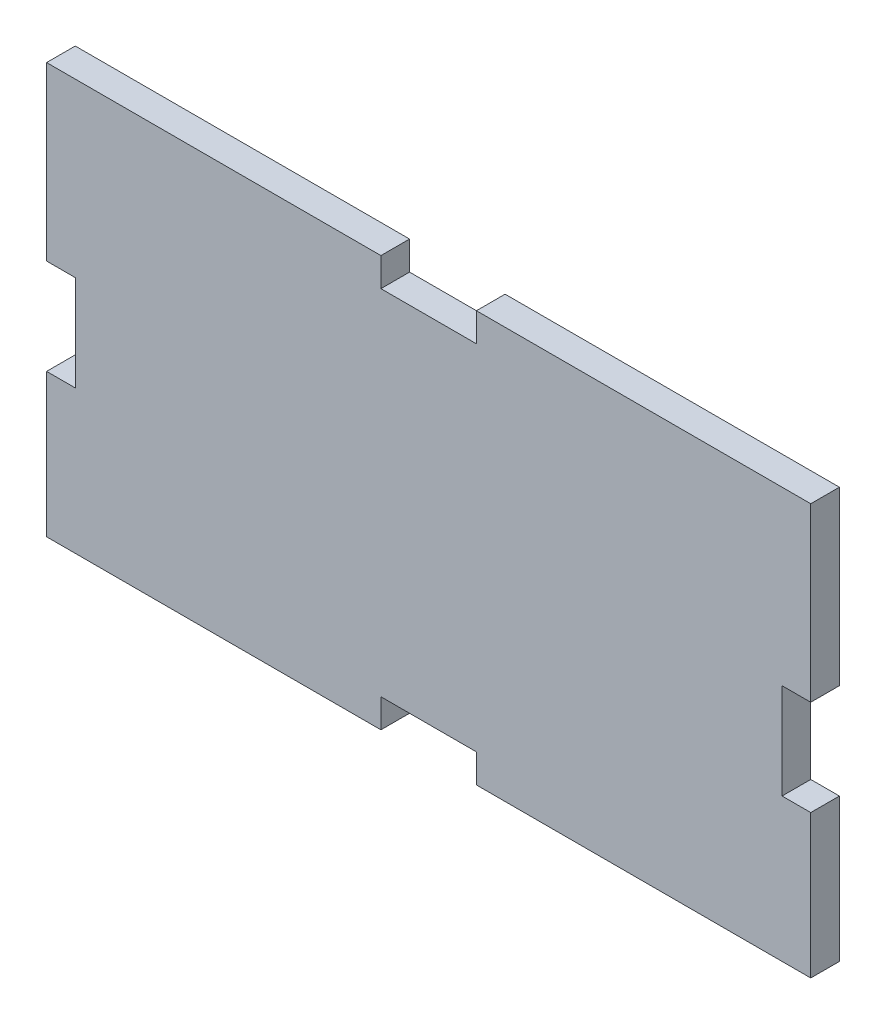
from build123d import *

# Parameters (mm, degrees)
BOSS_EXTRUDE1_DEPTH = 3


with BuildPart() as part:
    # Sketch1 → Boss-Extrude1 (new body)
    with BuildSketch(Plane.XY):
        Polygon((-32.643571906, 0), (-32.643571906, -18), (-29.643571906, -18), (-29.643571906, -28), (-32.643571906, -28), (-32.643571906, -43), (2.356428094, -43), (2.356428094, -40), (12.356428094, -40), (12.356428094, -43), (47.356428094, -43), (47.356428094, -28), (44.356428094, -28), (44.356428094, -18), (47.356428094, -18), (47.356428094, -3), (47.356428094, 0), (12.356428094, 0), (12.356428094, -3), (2.356428094, -3), (2.356428094, 0), align=None)
    extrude(amount=BOSS_EXTRUDE1_DEPTH)


solid = part.part
